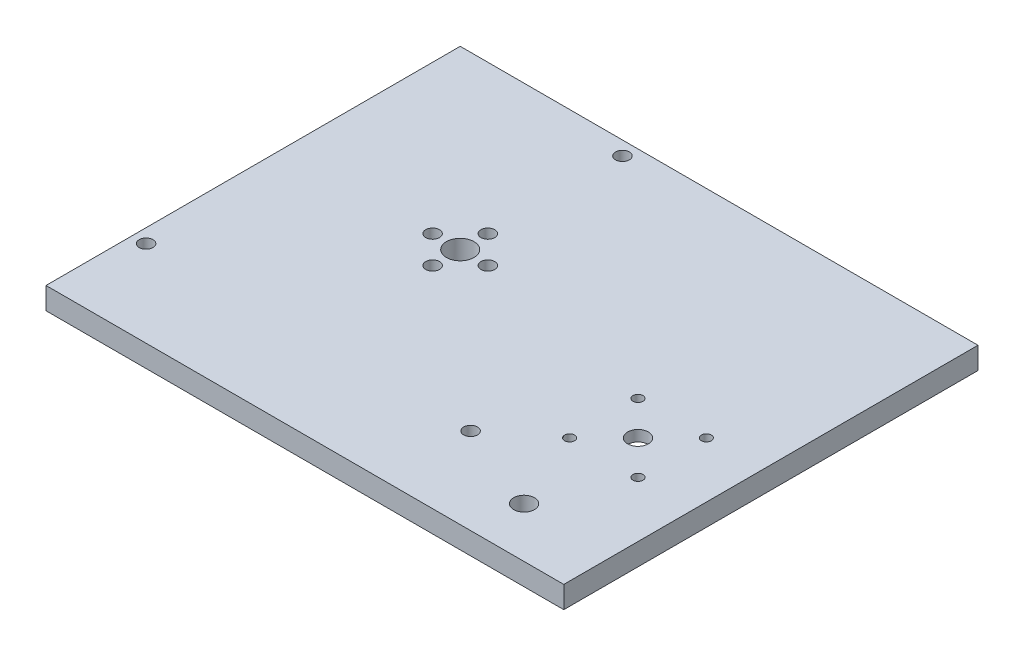
from build123d import *

# Parameters (mm, degrees)
SKETCH1_W           = 150
SKETCH1_H           = 120
BOSS_EXTRUDE1_DEPTH = 6.35
SKETCH2_R           = 2
SKETCH2_R_2         = 4
CUT_EXTRUDE1_DEPTH  = 10
SKETCH3_R           = 11
CUT_EXTRUDE2_DEPTH  = 3.21
SKETCH4_R           = 1.45
CUT_EXTRUDE3_DEPTH  = 6.35


with BuildPart() as part:
    # Sketch1 → Boss-Extrude1 (new body)
    with BuildSketch(Plane(origin=(0, 0, 0), x_dir=(1, 0, 0), z_dir=(0, 1, 0))):
        with Locations((75, 60)):
            Rectangle(SKETCH1_W, SKETCH1_H)
    extrude(amount=BOSS_EXTRUDE1_DEPTH)

    # Sketch2 → Cut-Extrude1 (cut)
    with BuildSketch(Plane(origin=(0, 6.35, 0), x_dir=(1, 0, 0), z_dir=(0, 1, 0))):
        with Locations(Location((51, 116, 0), (0, 0, 270))):
            Circle(SKETCH2_R)
        with Locations(Location((4, 25, 0), (0, 0, 270))):
            Circle(SKETCH2_R)
        with Locations(Location((98, 25, 0), (0, 0, 270))):
            Circle(SKETCH2_R)
        with BuildLine():
            ThreePointArc((127, 14.5), (126.121320344, 16.621320344), (124, 17.5))
            Line((124, 17.5), (124, 14.5))
            Line((124, 14.5), (124, 11.5))
            ThreePointArc((124, 11.5), (126.121320344, 12.378679656), (127, 14.5))
        make_face()
        with BuildLine():
            Line((124, 14.5), (124, 17.5))
            ThreePointArc((124, 17.5), (121.878679656, 16.621320344), (121, 14.5))
            Line((121, 14.5), (124, 14.5))
        make_face()
        with BuildLine():
            Line((124, 14.5), (121, 14.5))
            ThreePointArc((121, 14.5), (121.878679656, 12.378679656), (124, 11.5))
            Line((124, 11.5), (124, 14.5))
        make_face()
        with BuildLine():
            ThreePointArc((121, 47.5), (121.878679656, 45.378679656), (124, 44.5))
            Line((124, 44.5), (124, 47.5))
            Line((124, 47.5), (121, 47.5))
        make_face()
        with BuildLine():
            ThreePointArc((124, 50.5), (121.878679656, 49.621320344), (121, 47.5))
            Line((121, 47.5), (124, 47.5))
            Line((124, 47.5), (124, 50.5))
        make_face()
        with BuildLine():
            Line((124, 47.5), (124, 44.5))
            ThreePointArc((124, 44.5), (126.121320344, 45.378679656), (127, 47.5))
            ThreePointArc((127, 47.5), (126.121320344, 49.621320344), (124, 50.5))
            Line((124, 50.5), (124, 47.5))
        make_face()
        with Locations(Location((51, 77, 0), (0, 0, 270))):
            Circle(SKETCH2_R)
        with Locations(Location((43, 69, 0), (0, 0, 270))):
            Circle(SKETCH2_R)
        with Locations(Location((51, 69, 0), (0, 0, 270))):
            Circle(SKETCH2_R_2)
        with Locations(Location((59, 69, 0), (0, 0, 270))):
            Circle(SKETCH2_R)
        with Locations(Location((51, 61, 0), (0, 0, 270))):
            Circle(SKETCH2_R)
    extrude(amount=-CUT_EXTRUDE1_DEPTH, mode=Mode.SUBTRACT)

    # Sketch3 → Cut-Extrude2 (cut)
    with BuildSketch(Plane.XZ):
        with Locations(Location((124, -47.5, 0), (0, 0, 270))):
            Circle(SKETCH3_R)
    extrude(amount=-CUT_EXTRUDE2_DEPTH, mode=Mode.SUBTRACT)

    # Sketch4 → Cut-Extrude3 (cut)
    with BuildSketch(Plane(origin=(0, 6.35, 0), x_dir=(1, 0, 0), z_dir=(0, 1, 0))):
        with Locations(Location((133.899494937, 57.399494937, 0), (0, 0, 270))):
            Circle(SKETCH4_R)
        with Locations(Location((114.100505063, 37.600505063, 0), (0, 0, 270))):
            Circle(SKETCH4_R)
        with Locations(Location((133.899494937, 37.600505063, 0), (0, 0, 270))):
            Circle(SKETCH4_R)
        with Locations(Location((114.100505063, 57.399494937, 0), (0, 0, 270))):
            Circle(SKETCH4_R)
    extrude(amount=-CUT_EXTRUDE3_DEPTH, mode=Mode.SUBTRACT)


solid = part.part
